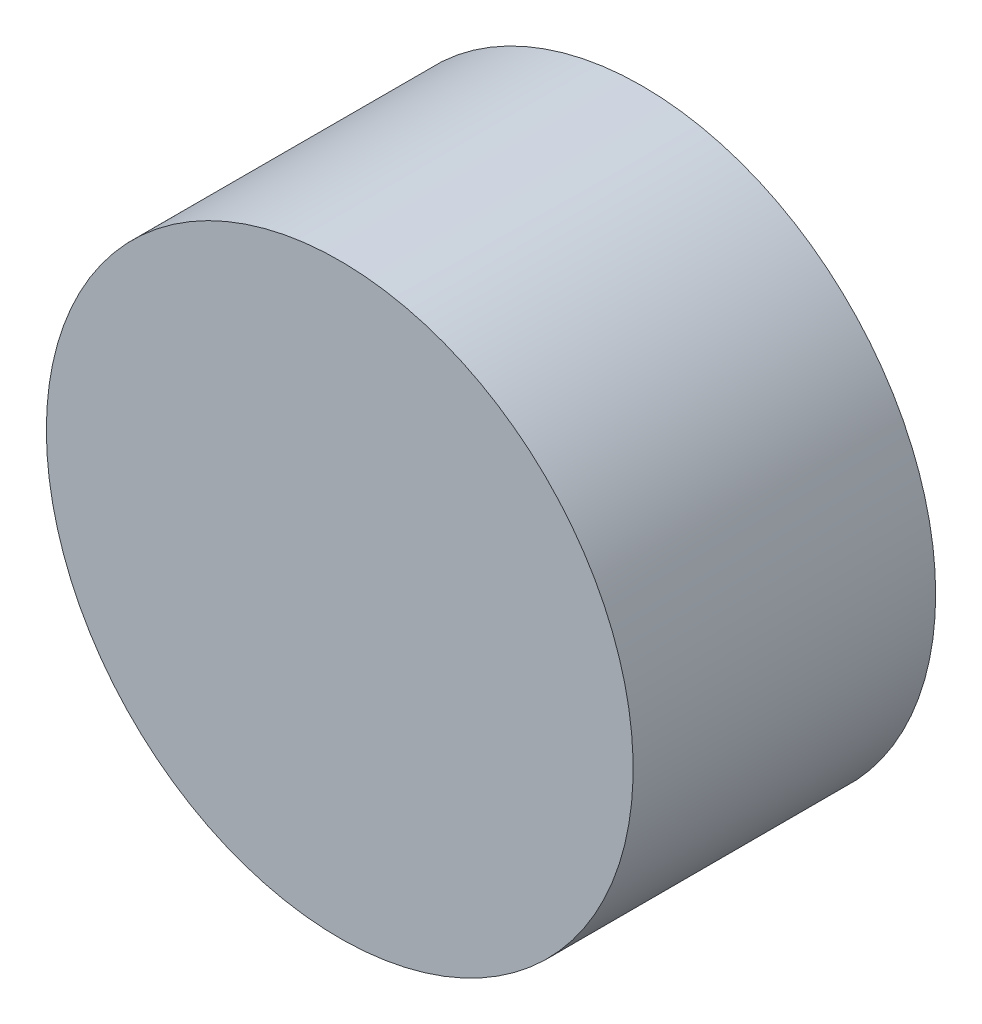
from build123d import *

# Parameters (mm, degrees)
SKETCH1_W             = 128.922622712
SKETCH1_H             = 108.547542538
SKETCH1_W_2           = 124.922622712
SKETCH1_H_2           = 104.547542538
BOSS_EXTRUDE1_DEPTH   = 50
SKETCH2_R             = 48.496570744
BOSS_EXTRUDE2_DEPTH   = 50
SKETCH3_R             = 6.994110628
BOSS_EXTRUDE3_DEPTH   = 20
SKETCH3_R_2           = 6.120691225
BOSS_EXTRUDE3_2_DEPTH = 20


with BuildPart() as part:
    # Sketch1 → Boss-Extrude1 (new body)
    with BuildSketch(Plane.XY):
        Rectangle(SKETCH1_W, SKETCH1_H)
        Rectangle(SKETCH1_W_2, SKETCH1_H_2, mode=Mode.SUBTRACT)
    extrude(amount=BOSS_EXTRUDE1_DEPTH)


with BuildPart() as body_2:
    # Sketch2 → Boss-Extrude2 (new body)
    with BuildSketch(Plane.XY):
        with Locations(Location((0, 0, 0), (0, 0, 180))):
            Circle(SKETCH2_R)
    extrude(amount=BOSS_EXTRUDE2_DEPTH)


with BuildPart() as body_3:
    # Sketch3 → Boss-Extrude3 (new body)
    with BuildSketch(Plane.XY):
        with Locations((-51.126362865, 41.516845757)):
            Circle(SKETCH3_R)
    extrude(amount=BOSS_EXTRUDE3_DEPTH)


with BuildPart() as body_4:
    # Sketch3 → Boss-Extrude3 2 (new body)
    with BuildSketch(Plane.XY):
        with Locations((46.461548735, 43.755956539)):
            Circle(SKETCH3_R_2)
    extrude(amount=BOSS_EXTRUDE3_2_DEPTH)


solid = body_2.part
